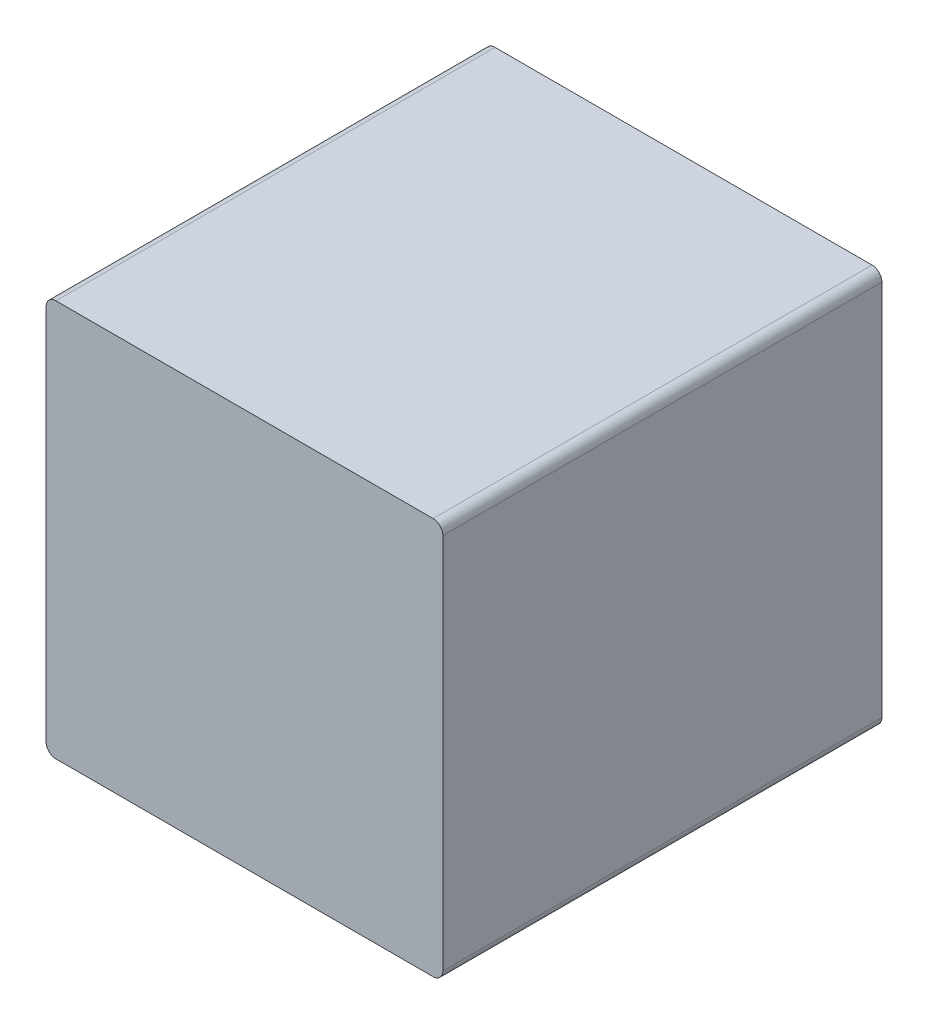
from build123d import *

# Parameters (mm, degrees)
BUTTON_CAP_ENVELOPE_12P11_DEPTH = 13.4


with BuildPart() as part:
    # 草图1 → Button_cap_envelope_12p11 (new body)
    with BuildSketch(Plane.XY):
        with BuildLine():
            Line((-5.755, -6.055), (5.755, -6.055))
            ThreePointArc((5.755, -6.055), (5.967132034, -5.967132034), (6.055, -5.755))
            Line((6.055, -5.755), (6.055, 5.755))
            ThreePointArc((6.055, 5.755), (5.967132034, 5.967132034), (5.755, 6.055))
            Line((5.755, 6.055), (-5.755, 6.055))
            ThreePointArc((-5.755, 6.055), (-5.967132034, 5.967132034), (-6.055, 5.755))
            Line((-6.055, 5.755), (-6.055, -5.755))
            ThreePointArc((-6.055, -5.755), (-5.967132034, -5.967132034), (-5.755, -6.055))
        make_face()
    extrude(amount=BUTTON_CAP_ENVELOPE_12P11_DEPTH)


solid = part.part
